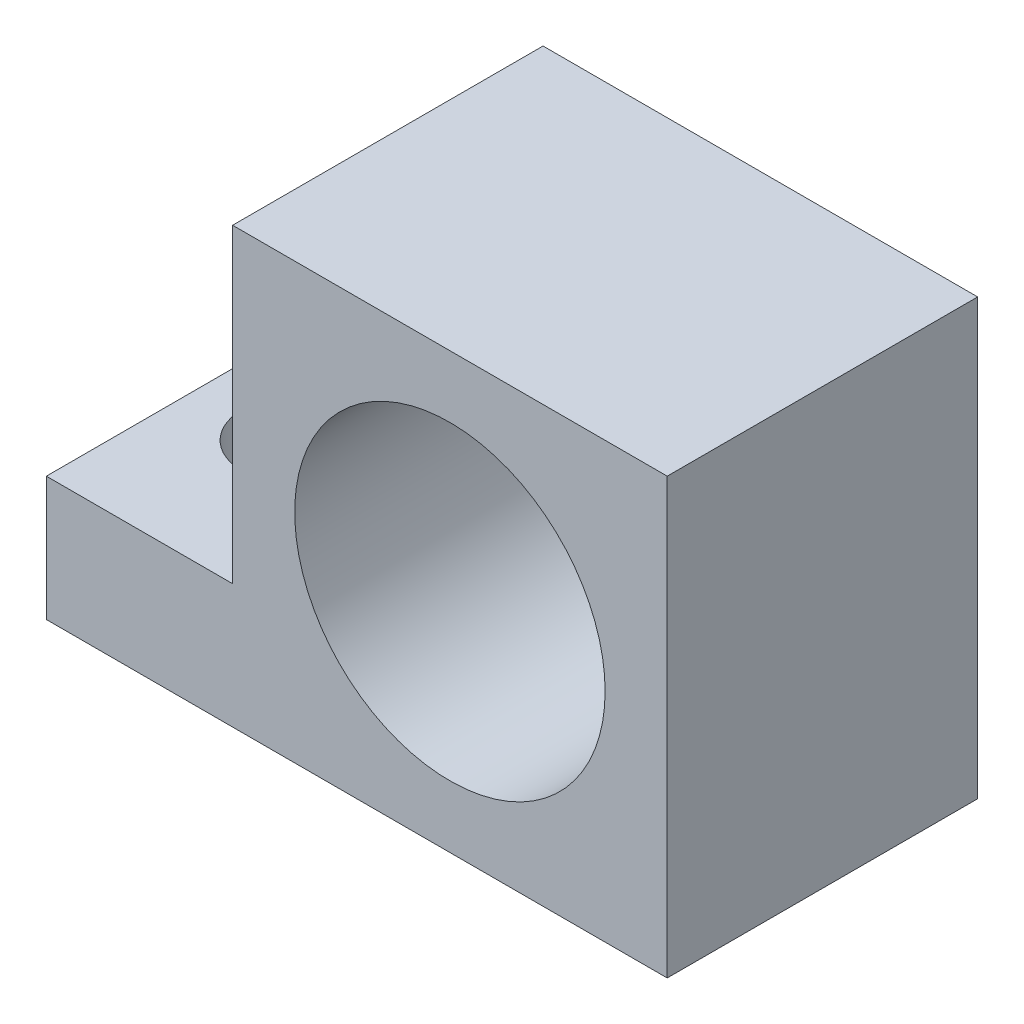
from build123d import *

# Parameters (mm, degrees)
SKETCH1_R            = 5
BOSS_EXTRUDE1_DEPTH  = 10
M3_CLEARANCE_HOLE1_D = 3.4


with BuildPart() as part:
    # Sketch1 → Boss-Extrude1 (new body)
    with BuildSketch(Plane.XY):
        Polygon((0, 0), (20, 0), (20, 14), (6, 14), (6, 4), (0, 4), align=None)
        with Locations((13, 7)):
            Circle(SKETCH1_R, mode=Mode.SUBTRACT)
    extrude(amount=BOSS_EXTRUDE1_DEPTH)

    # M3 Clearance Hole1 (through all)
    with Locations(Plane(origin=(0, 4, 0), x_dir=(-1, 0, 0), z_dir=(0, 1, 0))):
        with Locations((-3, 5)):
            Hole(M3_CLEARANCE_HOLE1_D / 2)


solid = part.part
